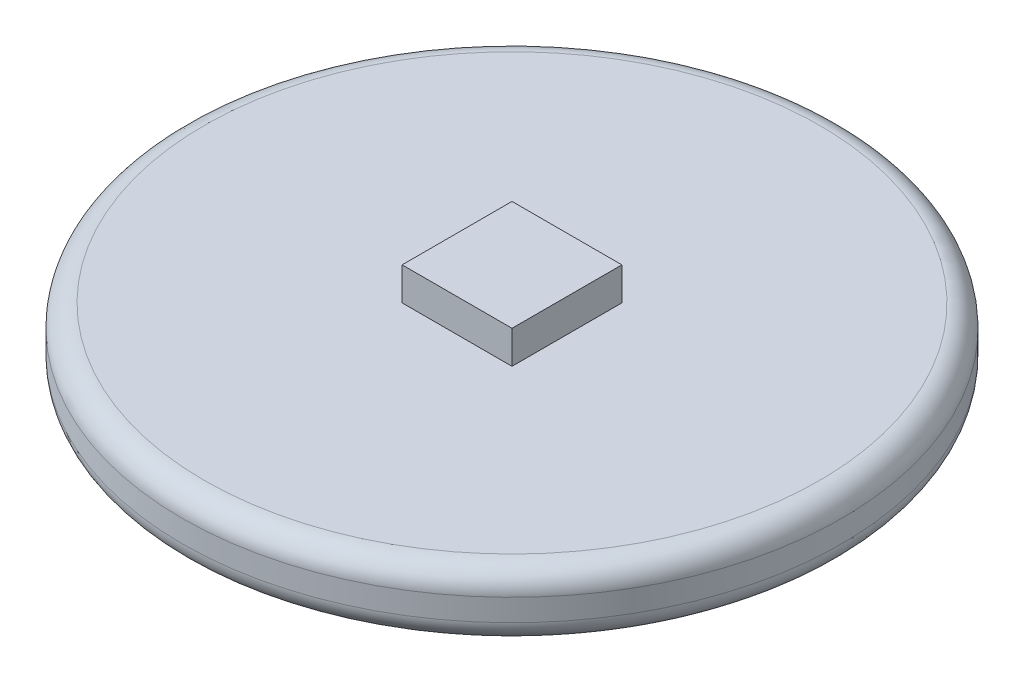
from build123d import *

# Parameters (mm, degrees)
SKETCH1_R           = 30
BOSS_EXTRUDE1_DEPTH = 6
FILLET2_R           = 2
SKETCH3_W           = 10
SKETCH3_H           = 10
BOSS_EXTRUDE3_DEPTH = 3


with BuildPart() as part:
    # Sketch1 → Boss-Extrude1 (new body)
    with BuildSketch(Plane(origin=(0, 0, 0), x_dir=(1, 0, 0), z_dir=(0, 1, 0))):
        with Locations(Location((0, 0, 0), (0, 0, 270))):
            Circle(SKETCH1_R)
    extrude(amount=BOSS_EXTRUDE1_DEPTH)

    # Fillet2
    fillet2_edges = [part.edges().sort_by_distance(p)[0] for p in [
        (0, 0, -30),
        (0, 6, -30),
    ]]
    fillet(fillet2_edges, radius=FILLET2_R)

    # Sketch3 → Boss-Extrude3 (add)
    with BuildSketch(Plane(origin=(0, 6, 0), x_dir=(1, 0, 0), z_dir=(0, 1, 0))):
        Rectangle(SKETCH3_W, SKETCH3_H)
    extrude(amount=BOSS_EXTRUDE3_DEPTH)


solid = part.part
